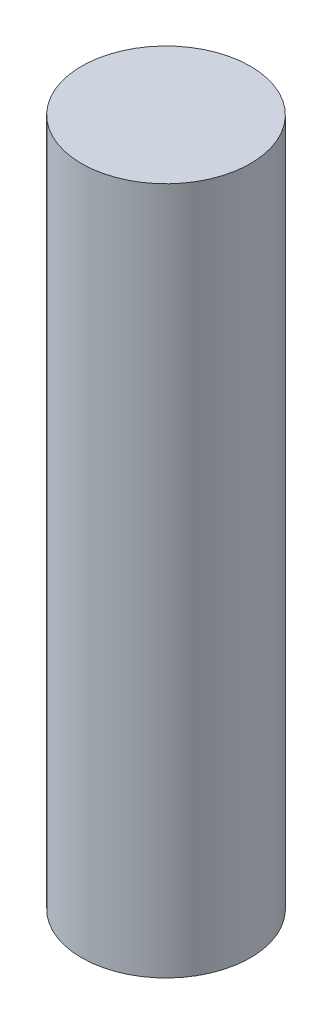
from build123d import *

# Parameters (mm, degrees)
SKETCH1_R           = 13.5
BOSS_EXTRUDE1_DEPTH = 55


with BuildPart() as part:
    # Sketch1 → Boss-Extrude1 (new, symmetric)
    with BuildSketch(Plane(origin=(0, 0, 0), x_dir=(1, 0, 0), z_dir=(0, 1, 0))):
        with Locations(Location((0, 0, 0), (0, 0, 270))):
            Circle(SKETCH1_R)
    extrude(amount=BOSS_EXTRUDE1_DEPTH, both=True)


solid = part.part
